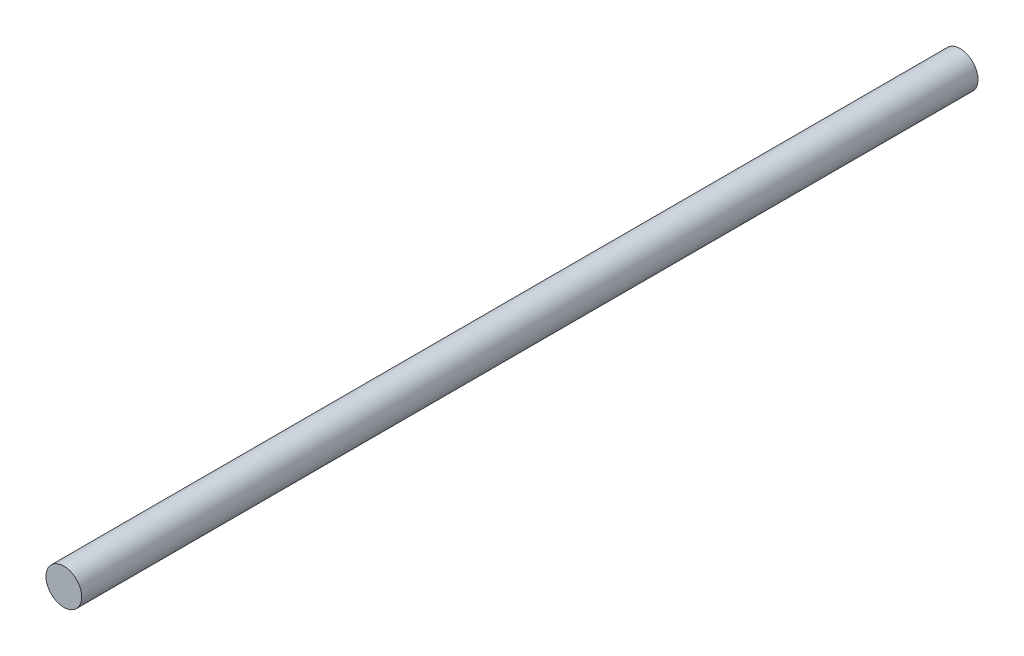
from build123d import *

# Parameters (mm, degrees)
SKETCH_1_R      = 1.5
EXTRUDE_1_DEPTH = 75.24


with BuildPart() as part:
    # 草圖1 → 填料-伸長1 (new body)
    with BuildSketch(Plane.XY):
        Circle(SKETCH_1_R)
    extrude(amount=EXTRUDE_1_DEPTH)


solid = part.part
